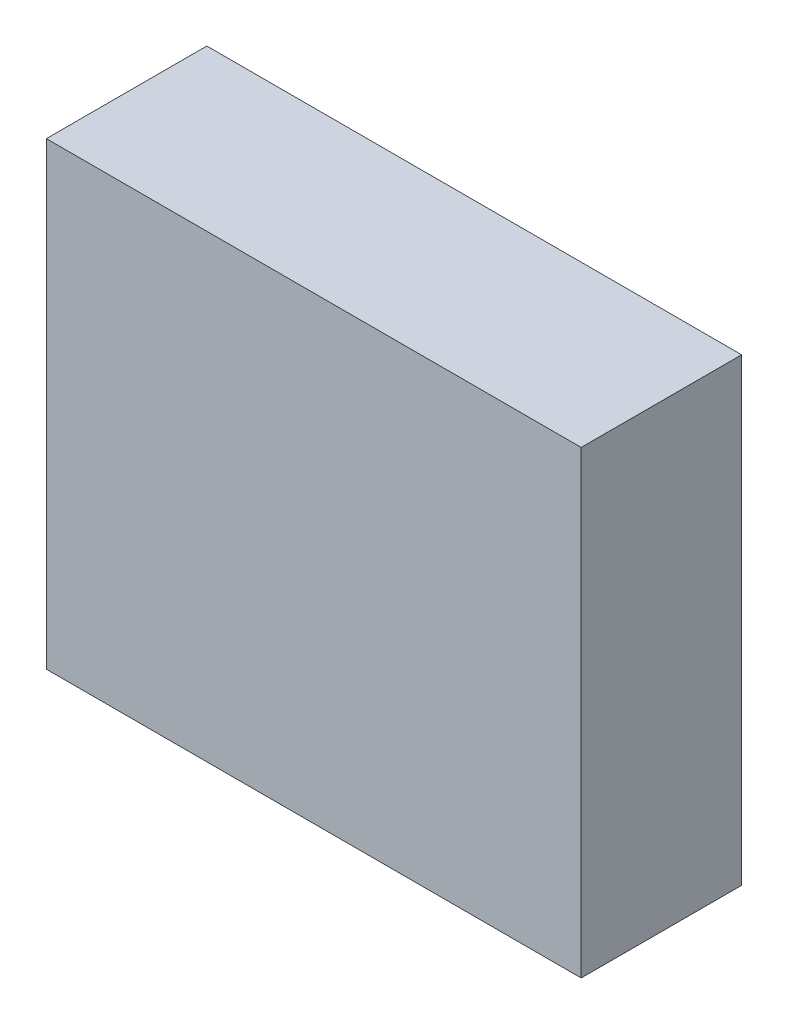
from build123d import *

# Parameters (mm, degrees)
SKETCH1_W               = 7.1000112
SKETCH1_H               = 6.0999878
COMPONENT_OUTLINE_DEPTH = 2.1299932


with BuildPart() as part:
    # Sketch1 → Component_Outline (new body)
    with BuildSketch(Plane.XY):
        with Locations((0, 1.27e-05)):
            Rectangle(SKETCH1_W, SKETCH1_H)
    extrude(amount=COMPONENT_OUTLINE_DEPTH)


solid = part.part
